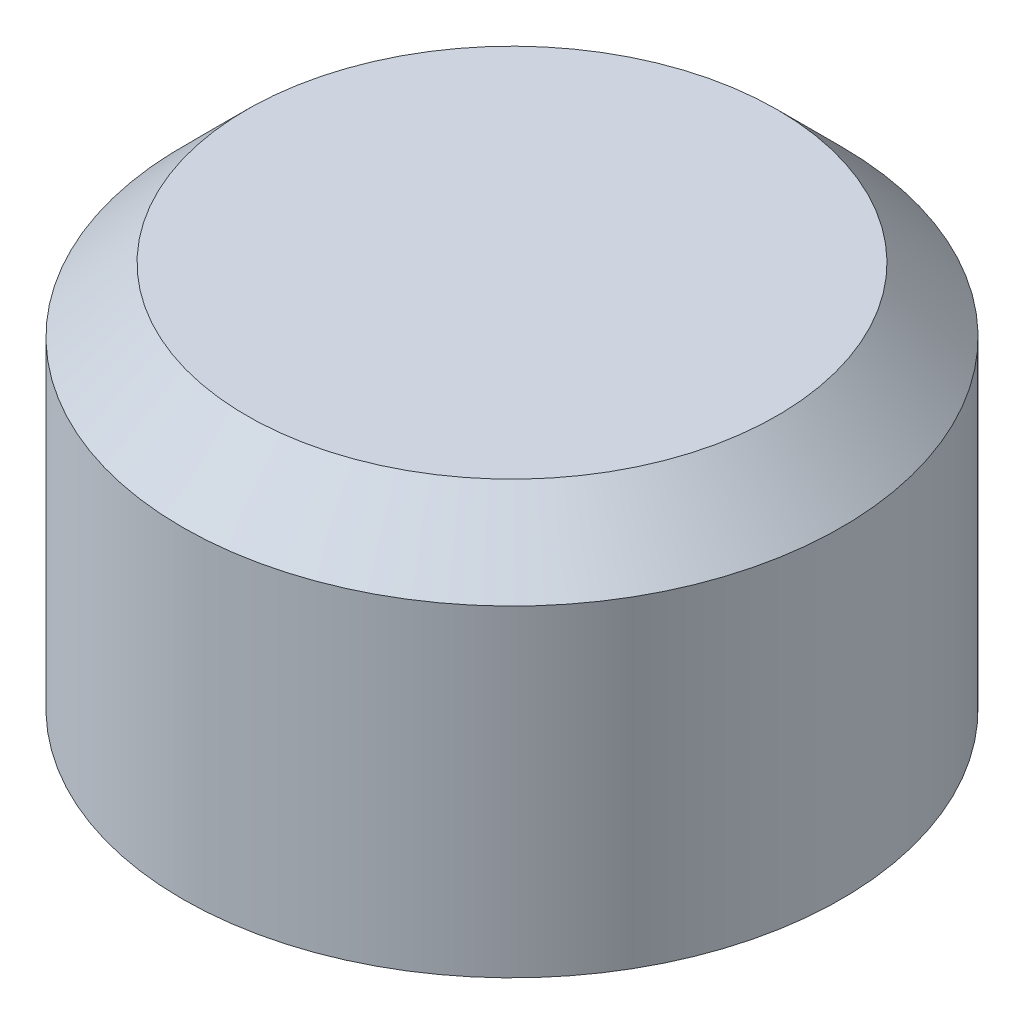
from build123d import *

# Parameters (mm, degrees)
SKETCH1_R           = 6.4999997
BOSS_EXTRUDE1_DEPTH = 7.62
CHAMFER2_SIZE       = 1.27


with BuildPart() as part:
    # Sketch1 → Boss-Extrude1 (new body)
    with BuildSketch(Plane(origin=(0, 0, 0), x_dir=(1, 0, 0), z_dir=(0, 1, 0))):
        with Locations(Location((0, 0, 0), (0, 0, 90))):
            Circle(SKETCH1_R)
    extrude(amount=BOSS_EXTRUDE1_DEPTH)

    # Chamfer2
    chamfer2_edges = [part.edges().sort_by_distance(p)[0] for p in [
        (0, 7.62, 6.4999997),
    ]]
    chamfer(chamfer2_edges, length=CHAMFER2_SIZE)


solid = part.part
